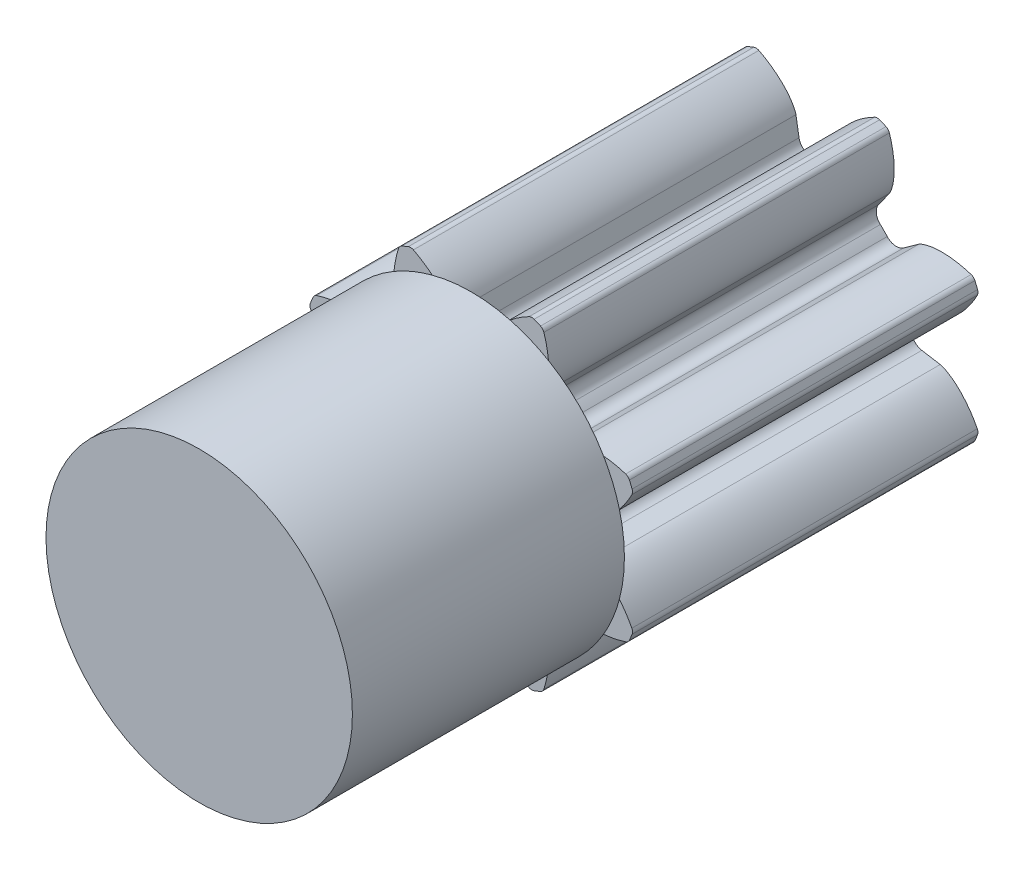
from build123d import *

# Parameters (mm, degrees)
SKETCH1_R                                 = 6.35
BOSS_EXTRUDE1_DEPTH                       = 12.7
CUT_EXTRUDE_DCLTBC_DEPTH                  = 16.554259867
FILLET_TIP_DCLTBC_R                       = 0.225840649
FILLET_ROOT_DCLTBC_R                      = 0.451681298
CIRPATTERN_DCLTBC_COUNT                   = 8
FILLET_TIP_DCLTBC_OF_CIRPATTERN_DCLTBC_R  = 0.225840649
FILLET_ROOT_DCLTBC_OF_CIRPATTERN_DCLTBC_R = 0.451681298
SKETCH4_R                                 = 5.63194408
BOSS_EXTRUDE2_DEPTH                       = 10


with BuildPart() as part:
    # Sketch1 → Boss-Extrude1 (new body)
    with BuildSketch(Plane.XY):
        Circle(SKETCH1_R)
    extrude(amount=BOSS_EXTRUDE1_DEPTH)

    # DCLTBC → Cut-Extrude-DCLTBC (cut, through all)
    with BuildSketch(Plane.XY):
        with BuildLine():
            Line((-0.762465098, 4.540469586), (-0.578384918, 3.444274544))
            ThreePointArc((-0.578384918, 3.444274544), (0, 3.4925), (0.578384918, 3.444274544))
            Line((0.578384918, 3.444274544), (0.762465098, 4.540469586))
            add(Edge.make_bspline(
                [(0.762465098, 4.540469586), (0.763034569, 4.543488036), (0.764819237, 4.551916605), (0.76893175, 4.567695247), (0.776679583, 4.593170604), (0.788064453, 4.625194838), (0.804494842, 4.666017173), (0.826031097, 4.713311361), (0.851950921, 4.764372266), (0.882541397, 4.81885718), (0.915143498, 4.872208333), (0.949571882, 4.924436701), (0.985567444, 4.975533126), (1.031137898, 5.036269094), (1.088495994, 5.107448593), (1.159378781, 5.188095877), (1.244219696, 5.276436139), (1.335260486, 5.362928889), (1.428549343, 5.445061504), (1.526869968, 5.524445472), (1.624871525, 5.598686298), (1.730580349, 5.671902497), (1.830170937, 5.737514811), (1.945834506, 5.80652891), (2.040393727, 5.860925157), (2.141307776, 5.913254628), (2.190891549, 5.938148554), (2.216425711, 5.950626611)],
                knots=[0, 0, 0, 0, 0, 0.005376748, 0.015083688, 0.02853182, 0.046610139, 0.064854849, 0.092110525, 0.119476175, 0.146842495, 0.174208853, 0.201574955, 0.228941013, 0.256307345, 0.307035032, 0.361767351, 0.41649966, 0.471231936, 0.525964281, 0.580696615, 0.635428982, 0.690161387, 0.744893688, 0.799626083, 0.854358408, 0.909090916, 0.909090916, 0.909090916, 0.909090916, 0.909090916], degree=4))
            ThreePointArc((2.216425711, 5.950626611), (0, 6.35), (-2.216425711, 5.950626611))
            add(Edge.make_bspline(
                [(-0.762465098, 4.540469586), (-0.763034569, 4.543488036), (-0.764819237, 4.551916605), (-0.76893175, 4.567695247), (-0.776679583, 4.593170604), (-0.788064453, 4.625194838), (-0.804494842, 4.666017173), (-0.826031097, 4.713311361), (-0.851950921, 4.764372266), (-0.882541397, 4.81885718), (-0.915143498, 4.872208333), (-0.949571882, 4.924436701), (-0.985567444, 4.975533126), (-1.031137898, 5.036269094), (-1.088495994, 5.107448593), (-1.159378781, 5.188095877), (-1.244219696, 5.276436139), (-1.335260486, 5.362928889), (-1.428549343, 5.445061504), (-1.526869968, 5.524445472), (-1.624871525, 5.598686298), (-1.730580349, 5.671902497), (-1.830170937, 5.737514811), (-1.945834506, 5.80652891), (-2.040393727, 5.860925157), (-2.141307776, 5.913254628), (-2.190891549, 5.938148554), (-2.216425711, 5.950626611)],
                knots=[0, 0, 0, 0, 0, 0.005376748, 0.015083688, 0.02853182, 0.046610139, 0.064854849, 0.092110525, 0.119476175, 0.146842495, 0.174208853, 0.201574955, 0.228941013, 0.256307345, 0.307035032, 0.361767351, 0.41649966, 0.471231936, 0.525964281, 0.580696615, 0.635428982, 0.690161387, 0.744893688, 0.799626083, 0.854358408, 0.909090916, 0.909090916, 0.909090916, 0.909090916, 0.909090916], degree=4))
        make_face()
    cut_extrude_dcltbc = extrude(amount=CUT_EXTRUDE_DCLTBC_DEPTH, mode=Mode.SUBTRACT)

    # Fillet-Tip-DCLTBC
    fillet_tip_dcltbc_edges = [part.edges().sort_by_distance(p)[0] for p in [
        (2.216425711, 5.950626611, 6.35),
        (-2.216425711, 5.950626611, 6.35),
    ]]
    fillet(fillet_tip_dcltbc_edges, radius=FILLET_TIP_DCLTBC_R)

    # Fillet-Root-DCLTBC
    fillet_root_dcltbc_edges = [part.edges().sort_by_distance(p)[0] for p in [
        (0.578384918, 3.444274544, 6.35),
        (-0.578384918, 3.444274544, 6.35),
    ]]
    fillet(fillet_root_dcltbc_edges, radius=FILLET_ROOT_DCLTBC_R)

    # CirPattern-DCLTBC: Cut-Extrude-DCLTBC ×8 about axis
    cirpattern_dcltbc_axis = Axis((0, 0, 12.7), (0, 0, 1))
    for i in range(1, CIRPATTERN_DCLTBC_COUNT):
        add(cut_extrude_dcltbc.rotate(cirpattern_dcltbc_axis, i * 360 / CIRPATTERN_DCLTBC_COUNT), mode=Mode.SUBTRACT)

    # Fillet-Tip-DCLTBC of CirPattern-DCLTBC
    fillet_tip_dcltbc_of_cirpattern_dcltbc_edges = [part.edges().sort_by_distance(p)[0] for p in [
        (-2.640478779, 5.77497808, 6.35),
        (-5.77497808, 2.640478779, 6.35),
        (-5.950626611, 2.216425711, 6.35),
        (-5.950626611, -2.216425711, 6.35),
        (-5.77497808, -2.640478779, 6.35),
        (-2.640478779, -5.77497808, 6.35),
        (-2.216425711, -5.950626611, 6.35),
        (2.216425711, -5.950626611, 6.35),
        (2.640478779, -5.77497808, 6.35),
        (5.77497808, -2.640478779, 6.35),
        (5.950626611, -2.216425711, 6.35),
        (5.950626611, 2.216425711, 6.35),
        (5.77497808, 2.640478779, 6.35),
        (2.640478779, 5.77497808, 6.35),
    ]]
    fillet(fillet_tip_dcltbc_of_cirpattern_dcltbc_edges, radius=FILLET_TIP_DCLTBC_OF_CIRPATTERN_DCLTBC_R)

    # Fillet-Root-DCLTBC of CirPattern-DCLTBC
    fillet_root_dcltbc_of_cirpattern_dcltbc_edges = [part.edges().sort_by_distance(p)[0] for p in [
        (-2.026489989, 2.844449784, 6.35),
        (-2.844449784, 2.026489989, 6.35),
        (-3.444274544, 0.578384918, 6.35),
        (-3.444274544, -0.578384918, 6.35),
        (-2.844449784, -2.026489989, 6.35),
        (-2.026489989, -2.844449784, 6.35),
        (-0.578384918, -3.444274544, 6.35),
        (0.578384918, -3.444274544, 6.35),
        (2.026489989, -2.844449784, 6.35),
        (2.844449784, -2.026489989, 6.35),
        (3.444274544, -0.578384918, 6.35),
        (3.444274544, 0.578384918, 6.35),
        (2.844449784, 2.026489989, 6.35),
        (2.026489989, 2.844449784, 6.35),
    ]]
    fillet(fillet_root_dcltbc_of_cirpattern_dcltbc_edges, radius=FILLET_ROOT_DCLTBC_OF_CIRPATTERN_DCLTBC_R)

    # Sketch4 → Boss-Extrude2 (add)
    with BuildSketch(Plane.XY.offset(12.7)):
        with Locations(Location((0, 0, 0), (0, 0, 165.266889092))):
            Circle(SKETCH4_R)
    extrude(amount=BOSS_EXTRUDE2_DEPTH)


solid = part.part
